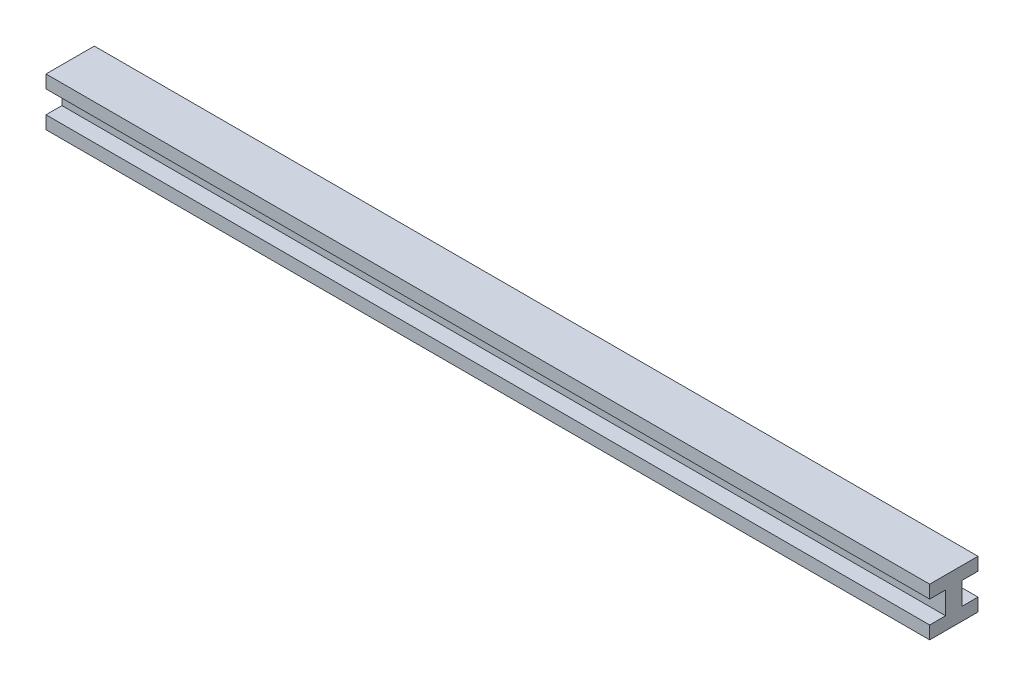
from build123d import *

# Parameters (mm, degrees)
BOSS_EXTRUDE1_DEPTH = 1500


with BuildPart() as part:
    # Sketch1 → Boss-Extrude1 (new body)
    with BuildSketch(Plane(origin=(0, 0, 0), x_dir=(0, 0, -1), z_dir=(1, 0, 0))):
        Polygon((55, -22), (82, -22), (82, 0), (0, 0), (0, -22), (27, -22), (27, -60), (0, -60), (0, -82), (82, -82), (82, -60), (55, -60), align=None)
    extrude(amount=BOSS_EXTRUDE1_DEPTH)


solid = part.part
